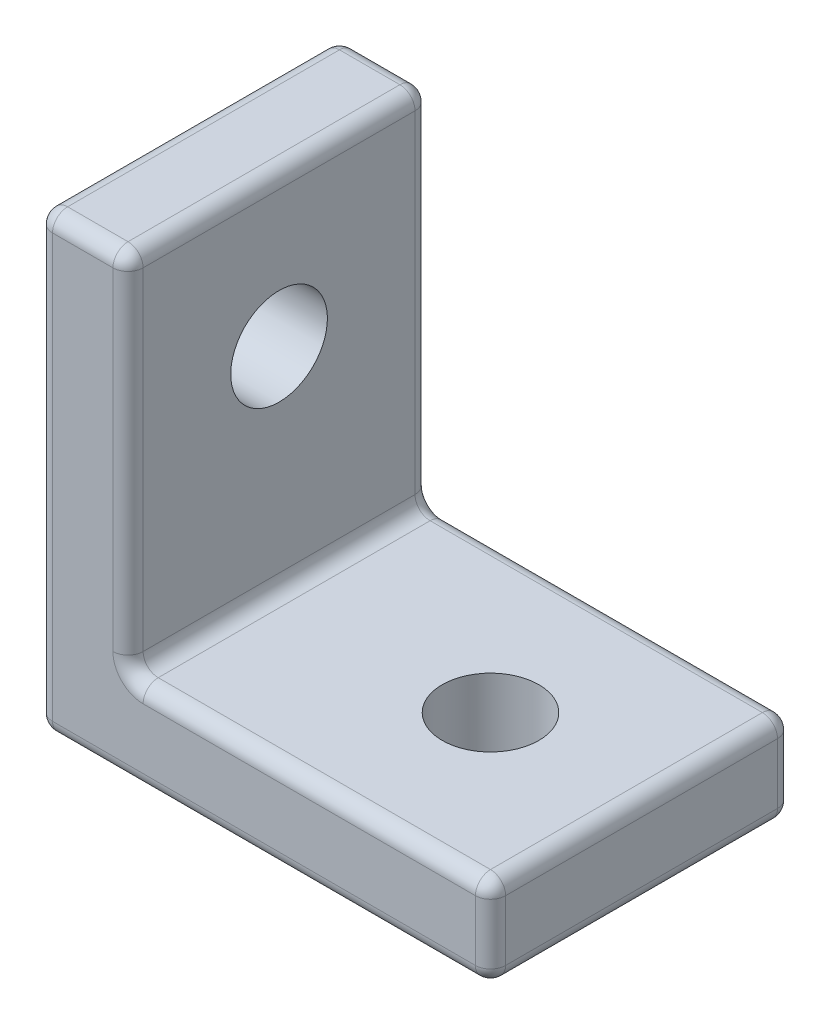
from build123d import *

# Parameters (mm, degrees)
EXTRUDE_1_DEPTH     = 10
SKETCH_3_R          = 1.6
CUT_EXTRUDE_1_DEPTH = 5
SKETCH_2_R          = 1.6
CUT_EXTRUDE_2_DEPTH = 5
FILLET_1_R          = 0.5


with BuildPart() as part:
    # Sketch 1 → 凸台-拉伸1 (new body)
    with BuildSketch(Plane.XY):
        Polygon((0, 15), (0, 0), (15, 0), (15, 3), (3, 3), (3, 15), align=None)
    extrude(amount=EXTRUDE_1_DEPTH)

    # 草图3 → 切除-拉伸1 (cut)
    with BuildSketch(Plane.XZ):
        with Locations(Location((10, 5, 0), (0, 0, 270))):
            Circle(SKETCH_3_R)
    extrude(amount=-CUT_EXTRUDE_1_DEPTH, mode=Mode.SUBTRACT)

    # Sketch 2 → 切除-拉伸2 (cut)
    with BuildSketch(Plane.ZY):
        with Locations(Location((5, 10, 0), (0, 0, 270))):
            Circle(SKETCH_2_R)
    extrude(amount=-CUT_EXTRUDE_2_DEPTH, mode=Mode.SUBTRACT)

    # 圆角1
    fillet_1_edges = [part.edges().sort_by_distance(p)[0] for p in [
        (3, 15, 5),
        (3, 3, 5),
        (15, 3, 5),
        (15, 0, 5),
        (0, 0, 5),
        (0, 15, 5),
        (7.5, 0, 10),
        (15, 1.5, 10),
        (9, 3, 10),
        (3, 9, 10),
        (1.5, 15, 10),
        (3, 9, 0),
        (9, 3, 0),
        (15, 1.5, 0),
        (7.5, 0, 0),
        (0, 7.5, 0),
        (1.5, 15, 0),
        (0, 7.5, 10),
    ]]
    fillet(fillet_1_edges, radius=FILLET_1_R)


solid = part.part
